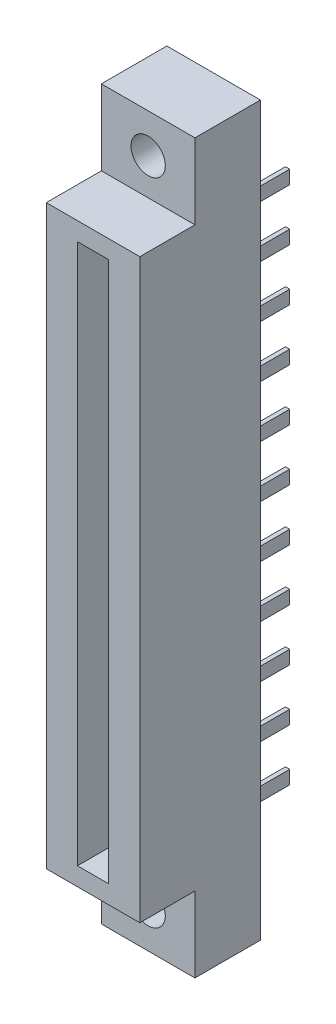
from build123d import *

# Parameters (mm, degrees)
SKETCH_1_W          = 9
SKETCH_1_H          = 70
EXTRUDE_1_DEPTH     = 6.3
SKETCH_2_W          = 9
SKETCH_2_H          = 55.5
EXTRUDE_2_DEPTH     = 5.3
SKETCH_3_R          = 1.65
CUT_EXTRUDE_1_DEPTH = 15.3
SKETCH_4_W          = 0.410265385
SKETCH_4_H          = 1.299173718
EXTRUDE_3_DEPTH     = 5
SKETCH_5_W          = 3
SKETCH_5_H          = 52
CUT_EXTRUDE_2_DEPTH = 8


with BuildPart() as part:
    # 草图1 → 拉伸1 (new body)
    with BuildSketch(Plane.XY):
        Rectangle(SKETCH_1_W, SKETCH_1_H)
    extrude(amount=EXTRUDE_1_DEPTH)

    # 草图2 → 拉伸2 (add)
    with BuildSketch(Plane.XY.offset(6.3)):
        Rectangle(SKETCH_2_W, SKETCH_2_H)
    extrude(amount=EXTRUDE_2_DEPTH)

    # 草图3 → 切除-拉伸1 (cut)
    with BuildSketch(Plane.XY.offset(6.3)):
        with Locations((0, 31.25)):
            Circle(SKETCH_3_R)
        with Locations((0, -31.25)):
            Circle(SKETCH_3_R)
    extrude(amount=-CUT_EXTRUDE_1_DEPTH, mode=Mode.SUBTRACT)

    # 草图4 → 拉伸3 (add)
    with BuildSketch(Plane(origin=(0, 0, 0), x_dir=(-1, 0, 0), z_dir=(0, 0, -1))):
        with Locations((2.113574837, 25)):
            Rectangle(SKETCH_4_W, SKETCH_4_H)
        with Locations((-2.113574837, 25)):
            Rectangle(SKETCH_4_W, SKETCH_4_H)
        with Locations((2.428938656, 20)):
            Rectangle(SKETCH_4_W, SKETCH_4_H)
        with Locations((-2.113574837, 20)):
            Rectangle(SKETCH_4_W, SKETCH_4_H)
        with Locations((2.428938656, 15)):
            Rectangle(SKETCH_4_W, SKETCH_4_H)
        with Locations((-2.113574837, 15)):
            Rectangle(SKETCH_4_W, SKETCH_4_H)
        with Locations((2.428938656, 10)):
            Rectangle(SKETCH_4_W, SKETCH_4_H)
        with Locations((-2.113574837, 10)):
            Rectangle(SKETCH_4_W, SKETCH_4_H)
        with Locations((2.428938656, 5)):
            Rectangle(SKETCH_4_W, SKETCH_4_H)
        with Locations((-2.113574837, 5)):
            Rectangle(SKETCH_4_W, SKETCH_4_H)
        with Locations((2.428938656, 0)):
            Rectangle(SKETCH_4_W, SKETCH_4_H)
        with Locations((-2.113574837, 0)):
            Rectangle(SKETCH_4_W, SKETCH_4_H)
        with Locations((-2.113574837, -5)):
            Rectangle(SKETCH_4_W, SKETCH_4_H)
        with Locations((2.428938656, -5)):
            Rectangle(SKETCH_4_W, SKETCH_4_H)
        with Locations((-2.113574837, -10)):
            Rectangle(SKETCH_4_W, SKETCH_4_H)
        with Locations((2.428938656, -10)):
            Rectangle(SKETCH_4_W, SKETCH_4_H)
        with Locations((-2.113574837, -15)):
            Rectangle(SKETCH_4_W, SKETCH_4_H)
        with Locations((2.428938656, -15)):
            Rectangle(SKETCH_4_W, SKETCH_4_H)
        with Locations((-2.113574837, -20)):
            Rectangle(SKETCH_4_W, SKETCH_4_H)
        with Locations((2.428938656, -20)):
            Rectangle(SKETCH_4_W, SKETCH_4_H)
        with Locations((2.113574837, -25)):
            Rectangle(SKETCH_4_W, SKETCH_4_H)
        with Locations((-2.113574837, -25)):
            Rectangle(SKETCH_4_W, SKETCH_4_H)
    extrude(amount=EXTRUDE_3_DEPTH)

    # 草图5 → 切除-拉伸2 (cut)
    with BuildSketch(Plane.XY.offset(11.6)):
        Rectangle(SKETCH_5_W, SKETCH_5_H)
    extrude(amount=-CUT_EXTRUDE_2_DEPTH, mode=Mode.SUBTRACT)


solid = part.part
